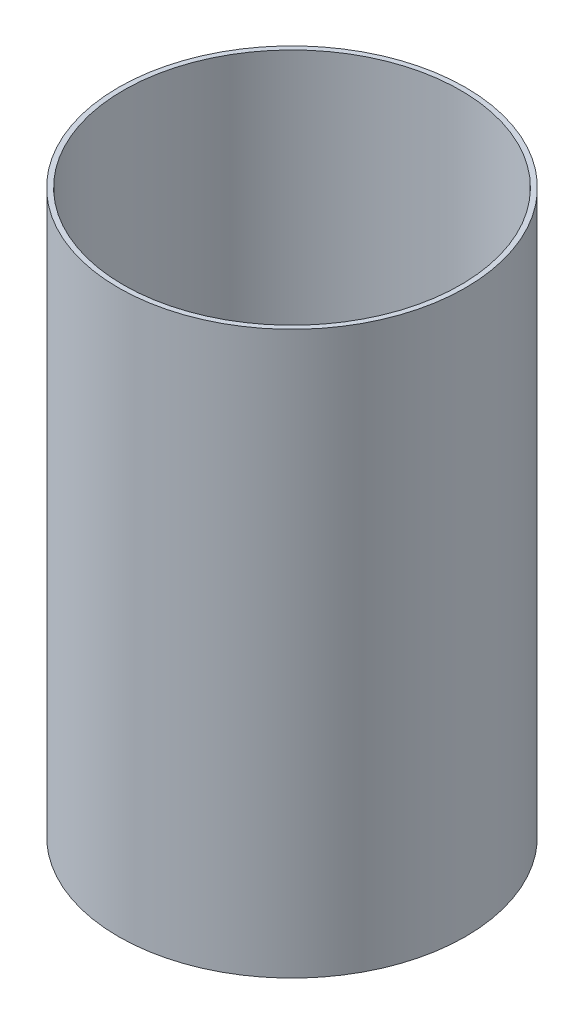
from build123d import *

# Parameters (mm, degrees)
BOSS_EXTRUDE1_DEPTH      = 3
BOSS_EXTRUDE1_DEPTH_BACK = 2.665329602
SKETCH1_R                = 1.75
CUT_EXTRUDE1_DEPTH       = 7.182310207
CUT_EXTRUDE1_DEPTH_BACK  = 3
SKETCH2_R                = 1.7


with BuildPart() as part:
    # Sketch1 → Boss-Extrude1 (new, two sides: drawn at the far end of the back side and taken through both)
    with BuildSketch(Plane(origin=(0, 0, 0), x_dir=(1, 0, 0), z_dir=(0, 1, 0)).offset(-BOSS_EXTRUDE1_DEPTH_BACK)):
        with Locations(Location((0, 0, 0), (0, 0, 270))):
            Circle(SKETCH1_R)
    extrude(amount=BOSS_EXTRUDE1_DEPTH + BOSS_EXTRUDE1_DEPTH_BACK)

    # Sketch2 → Cut-Extrude1 (cut, two sides: drawn at the far end of the back side and taken through both)
    with BuildSketch(Plane(origin=(0, 3, 0), x_dir=(1, 0, 0), z_dir=(0, 1, 0)).offset(-CUT_EXTRUDE1_DEPTH_BACK)):
        with Locations(Location((0, 0, 0), (0, 0, 270))):
            Circle(SKETCH2_R)
    extrude(amount=CUT_EXTRUDE1_DEPTH + CUT_EXTRUDE1_DEPTH_BACK, mode=Mode.SUBTRACT)


solid = part.part
